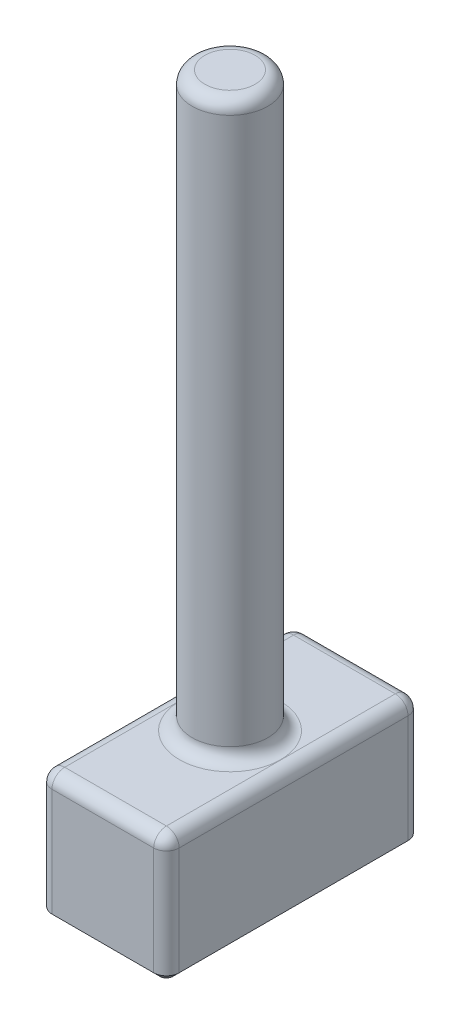
from build123d import *

# Parameters (mm, degrees)
SKETCH1_R           = 2.975
BOSS_EXTRUDE1_DEPTH = 50
SKETCH2_W           = 10.000004986
SKETCH2_H           = 10.000004986
BOSS_EXTRUDE2_DEPTH = 10
FILLET1_R           = 1
CHAMFER1_SIZE       = 0.5


with BuildPart() as part:
    # Sketch1 → Boss-Extrude1 (new body)
    with BuildSketch(Plane(origin=(0, 0, 0), x_dir=(1, 0, 0), z_dir=(0, 1, 0))):
        with Locations(Location((0, 0, 0), (0, 0, 270))):
            Circle(SKETCH1_R)
    extrude(amount=BOSS_EXTRUDE1_DEPTH)

    # Sketch2 → Boss-Extrude2 (add, symmetric)
    with BuildSketch(Plane.XY):
        Rectangle(SKETCH2_W, SKETCH2_H)
    extrude(amount=BOSS_EXTRUDE2_DEPTH, both=True)

    # Fillet1
    fillet1_edges = [part.edges().sort_by_distance(p)[0] for p in [
        (0, 50, -2.975),
        (0, 5.000002493, -2.975),
        (5.000002493, 0, -10),
        (0, 5.000002493, -10),
        (5.000002493, 5.000002493, 0),
        (-5.000002493, 0, -10),
        (-5.000002493, 5.000002493, 0),
        (5.000002493, 0, 10),
        (0, 5.000002493, 10),
        (-5.000002493, 0, 10),
    ]]
    fillet(fillet1_edges, radius=FILLET1_R)

    # Chamfer1
    chamfer1_edges = [part.edges().sort_by_distance(p)[0] for p in [
        (0, -5.000002493, 10),
        (0, -5.000002493, -10),
        (5.000002493, -5.000002493, 0),
        (-5.000002493, -5.000002493, 0),
        (4.707109274, -5.000002493, 9.707106781),
        (4.707109274, -5.000002493, -9.707106781),
        (-4.707109274, -5.000002493, -9.707106781),
        (-4.707109274, -5.000002493, 9.707106781),
    ]]
    chamfer(chamfer1_edges, length=CHAMFER1_SIZE)


solid = part.part
